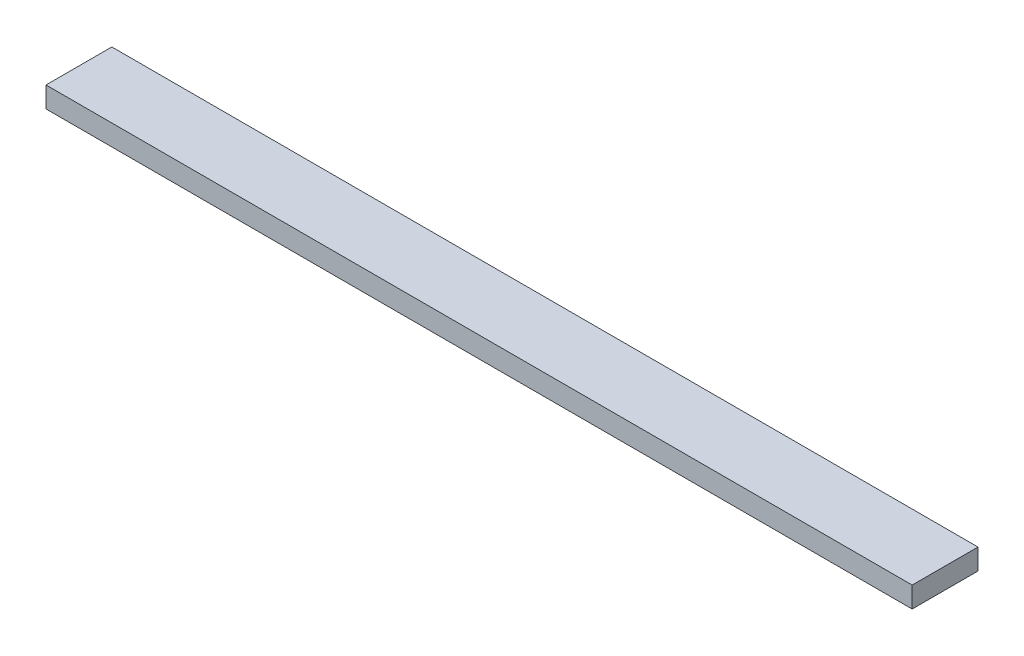
from build123d import *

# Parameters (mm, degrees)
SKETCH1_W           = 762
SKETCH1_H           = 57.912
BOSS_EXTRUDE1_DEPTH = 18.288


with BuildPart() as part:
    # Sketch1 → Boss-Extrude1 (new body)
    with BuildSketch(Plane(origin=(0, 0, 0), x_dir=(1, 0, 0), z_dir=(0, 1, 0))):
        with Locations((-310.829571311, -72.319831041)):
            Rectangle(SKETCH1_W, SKETCH1_H)
    extrude(amount=BOSS_EXTRUDE1_DEPTH)


solid = part.part
